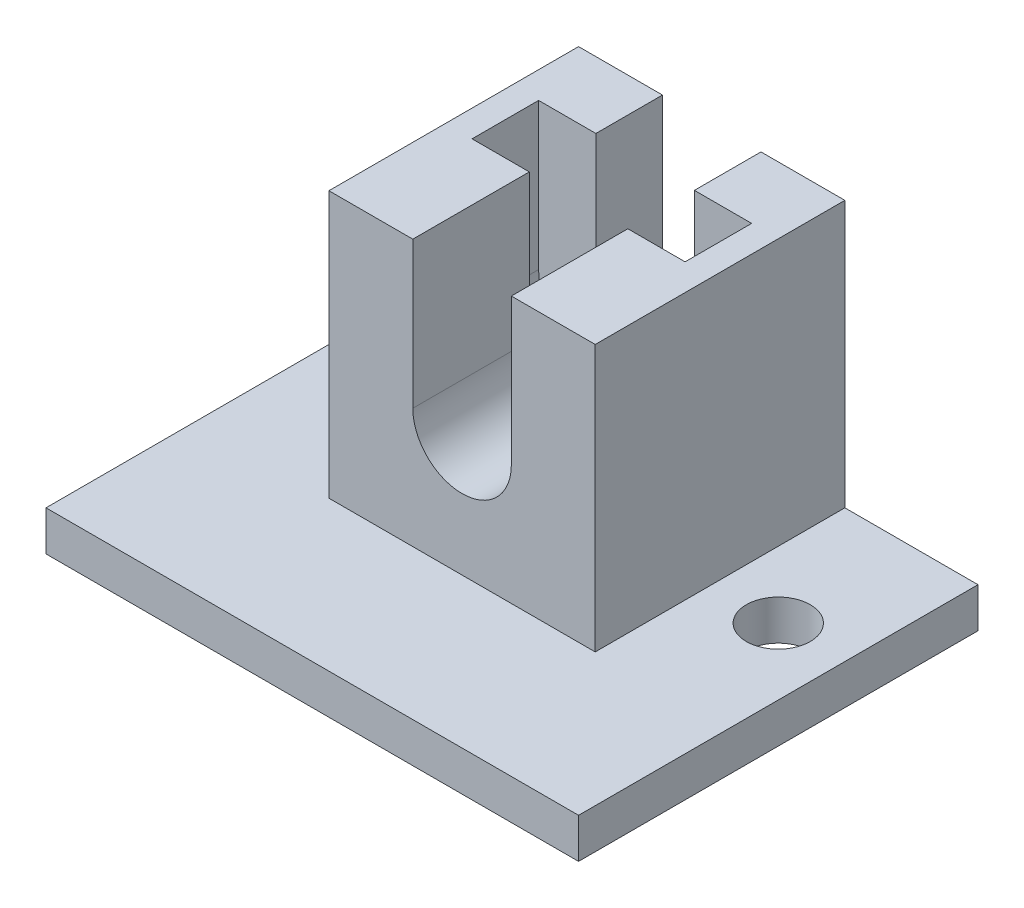
from build123d import *

# Parameters (mm, degrees)
ESQUISSE3_W                  = 10
ESQUISSE3_H                  = 15
ESQUISSE3_H_2                = 10
ESQUISSE3_H_3                = 5
BOSS_EXTRU_1_DEPTH           = 3
ESQUISSE4_W                  = 10
ESQUISSE4_H                  = 5
ESQUISSE4_H_2                = 3.75
BOSS_EXTRU_2_DEPTH           = 17
ENL_V_MAT_EXTRU_1_DEPTH      = 5
ENL_V_MAT_EXTRU_2_DEPTH      = 18.75
ESQUISSE8_W                  = 20
ESQUISSE8_H                  = 18.75
ESQUISSE8_W_2                = 16
ESQUISSE8_H_2                = 5
BOSS_EXTRU_3_DEPTH           = 3
ESQUISSE9_R                  = 3.7
ESQUISSE9_R_2                = 3
ENL_V_MAT_EXTRU_3_DEPTH      = 43.790987898
ENL_V_START                  = -6
ESQUISSE10_R                 = 2.4
ESQUISSE10_R_2               = 2
ENL_V_MAT_EXTRU_4_DEPTH      = 6
ENL_V_MAT_EXTRU_5_REACH      = 36.283
ENL_V_MAT_EXTRU_5_END_RADIUS = 3.7
ESQUISSE12_W                 = 3.7
ESQUISSE12_H                 = 5
ESQUISSE12_W_2               = 7.4
ESQUISSE12_H_2               = 8.75


with BuildPart() as part:
    # Esquisse3 → Boss.-Extru.1 (new body)
    with BuildSketch(Plane(origin=(0, 0, 0), x_dir=(1, 0, 0), z_dir=(0, 1, 0))):
        with Locations((-15.05164944, -6.870348765)):
            Rectangle(ESQUISSE3_W, ESQUISSE3_H)
        with Locations((14.94835056, -6.870348765)):
            Rectangle(ESQUISSE3_W, ESQUISSE3_H)
        with BuildLine():
            Line((-10.05164944, 5.629651235), (-10.05164944, 15.629651235))
            Line((-10.05164944, 15.629651235), (-20.05164944, 15.629651235))
            Line((-20.05164944, 15.629651235), (-20.05164944, 5.629651235))
            Line((-20.05164944, 5.629651235), (-17.05164944, 5.629651235))
            ThreePointArc((-17.05164944, 5.629651235), (-15.05164944, 7.629651235), (-13.05164944, 5.629651235))
            Line((-13.05164944, 5.629651235), (-10.05164944, 5.629651235))
        make_face()
        with BuildLine():
            Line((-10.05164944, 0.629651235), (-10.05164944, 5.629651235))
            Line((-10.05164944, 5.629651235), (-13.05164944, 5.629651235))
            ThreePointArc((-13.05164944, 5.629651235), (-15.05164944, 3.629651235), (-17.05164944, 5.629651235))
            Line((-17.05164944, 5.629651235), (-20.05164944, 5.629651235))
            Line((-20.05164944, 5.629651235), (-20.05164944, 0.629651235))
            Line((-20.05164944, 0.629651235), (-10.05164944, 0.629651235))
        make_face()
        with Locations((-5.05164944, 10.629651235)):
            Rectangle(ESQUISSE3_W, ESQUISSE3_H_2)
        with Locations((4.94835056, 10.629651235)):
            Rectangle(ESQUISSE3_W, ESQUISSE3_H_2)
        with BuildLine():
            Line((19.94835056, 15.629651235), (9.94835056, 15.629651235))
            Line((9.94835056, 15.629651235), (9.94835056, 5.629651235))
            Line((9.94835056, 5.629651235), (12.94835056, 5.629651235))
            ThreePointArc((12.94835056, 5.629651235), (14.94835056, 7.629651235), (16.94835056, 5.629651235))
            Line((16.94835056, 5.629651235), (19.94835056, 5.629651235))
            Line((19.94835056, 5.629651235), (19.94835056, 15.629651235))
        make_face()
        with BuildLine():
            Line((12.94835056, 5.629651235), (9.94835056, 5.629651235))
            Line((9.94835056, 5.629651235), (9.94835056, 0.629651235))
            Line((9.94835056, 0.629651235), (19.94835056, 0.629651235))
            Line((19.94835056, 0.629651235), (19.94835056, 5.629651235))
            Line((19.94835056, 5.629651235), (16.94835056, 5.629651235))
            ThreePointArc((16.94835056, 5.629651235), (14.94835056, 3.629651235), (12.94835056, 5.629651235))
        make_face()
        with Locations((4.94835056, -6.870348765)):
            Rectangle(ESQUISSE3_W, ESQUISSE3_H)
        with Locations((-5.05164944, -6.870348765)):
            Rectangle(ESQUISSE3_W, ESQUISSE3_H)
        with Locations((4.94835056, 3.129651235)):
            Rectangle(ESQUISSE3_W, ESQUISSE3_H_3)
        with Locations((-5.05164944, 3.129651235)):
            Rectangle(ESQUISSE3_W, ESQUISSE3_H_3)
    extrude(amount=BOSS_EXTRU_1_DEPTH)

    # Esquisse4 → Boss.-Extru.2 (add)
    with BuildSketch(Plane(origin=(0, 3, 0), x_dir=(1, 0, 0), z_dir=(0, 1, 0))):
        with Locations((-5.05164944, 3.129651235)):
            Rectangle(ESQUISSE4_W, ESQUISSE4_H)
        with Locations((-5.05164944, -1.245348765)):
            Rectangle(ESQUISSE4_W, ESQUISSE4_H_2)
        with Locations((4.94835056, -1.245348765)):
            Rectangle(ESQUISSE4_W, ESQUISSE4_H_2)
        with Locations((4.94835056, 3.129651235)):
            Rectangle(ESQUISSE4_W, ESQUISSE4_H)
        Polygon((-0.05164944, 15.629651235), (-0.05164944, 5.629651235), (9.94835056, 5.629651235), (9.94835056, 8.129651235), align=None)
        Polygon((-10.05164944, 8.129651235), (-10.05164944, 5.629651235), (-0.05164944, 5.629651235), (-0.05164944, 15.629651235), align=None)
        Polygon((-10.05164944, 15.629651235), (-10.05164944, 8.129651235), (-0.05164944, 15.629651235), align=None)
        Polygon((9.94835056, 15.629651235), (-0.05164944, 15.629651235), (9.94835056, 8.129651235), align=None)
    extrude(amount=BOSS_EXTRU_2_DEPTH)

    # Esquisse6 → Enlèv. mat.-Extru.1 (cut)
    with BuildSketch(Plane(origin=(0, 0, -10.629651235), x_dir=(-1, 0, 0), z_dir=(0, 0, -1))):
        with BuildLine():
            Line((8.05164944, 20), (-7.94835056, 20))
            Line((-7.94835056, 20), (-7.94835056, 12))
            ThreePointArc((-7.94835056, 12), (0.05164944, 4), (8.05164944, 12))
            Line((8.05164944, 12), (8.05164944, 20))
        make_face()
    extrude(amount=-ENL_V_MAT_EXTRU_1_DEPTH, mode=Mode.SUBTRACT)

    # Esquisse7 → Enlèv. mat.-Extru.2 (cut)
    with BuildSketch(Plane(origin=(0, 0, -15.629651235), x_dir=(-1, 0, 0), z_dir=(0, 0, -1))):
        with BuildLine():
            ThreePointArc((3.05164944, 12), (2.823288037, 13.148050297), (2.172969783, 14.121320344))
            Line((2.172969783, 14.121320344), (0.05164944, 12))
            Line((0.05164944, 12), (2.172969783, 9.878679656))
            ThreePointArc((2.172969783, 9.878679656), (2.823288037, 10.851949703), (3.05164944, 12))
        make_face()
        with BuildLine():
            Line((0.05164944, 12), (2.172969783, 14.121320344))
            ThreePointArc((2.172969783, 14.121320344), (0.05164944, 15), (-2.069670904, 14.121320344))
            Line((-2.069670904, 14.121320344), (0.05164944, 12))
        make_face()
        with BuildLine():
            ThreePointArc((-2.069670904, 9.878679656), (0.05164944, 9), (2.172969783, 9.878679656))
            Line((2.172969783, 9.878679656), (0.05164944, 12))
            Line((0.05164944, 12), (-2.069670904, 9.878679656))
        make_face()
        with BuildLine():
            Line((0.05164944, 12), (-2.069670904, 14.121320344))
            ThreePointArc((-2.069670904, 14.121320344), (-2.94835056, 12), (-2.069670904, 9.878679656))
            Line((-2.069670904, 9.878679656), (0.05164944, 12))
        make_face()
    extrude(amount=-ENL_V_MAT_EXTRU_2_DEPTH, mode=Mode.SUBTRACT)

    # Esquisse8 → Boss.-Extru.3 (add)
    with BuildSketch(Plane(origin=(0, 20, 0), x_dir=(1, 0, 0), z_dir=(0, 1, 0))):
        with Locations((-0.05164944, 6.254651235)):
            Rectangle(ESQUISSE8_W, ESQUISSE8_H)
        with Locations((-0.05164944, 8.129651235)):
            Rectangle(ESQUISSE8_W_2, ESQUISSE8_H_2, mode=Mode.SUBTRACT)
    extrude(amount=BOSS_EXTRU_3_DEPTH)

    # Esquisse9 → Enlèv. mat.-Extru.3 (cut, through all)
    with BuildSketch(Plane(origin=(0, 0, -15.629651235), x_dir=(-1, 0, 0), z_dir=(0, 0, -1))):
        with Locations((0.05164944, 12)):
            Circle(ESQUISSE9_R)
        with Locations((0.05164944, 12)):
            Circle(ESQUISSE9_R_2, mode=Mode.SUBTRACT)
    extrude(amount=-ENL_V_MAT_EXTRU_3_DEPTH, mode=Mode.SUBTRACT)

    # Esquisse10 → Enlèv. mat.-Extru.4 (cut)
    # profile 1 of 2: a face of its own
    with BuildSketch(Plane(origin=(0, 3, 0), x_dir=(1, 0, 0), z_dir=(0, 1, 0)).offset(ENL_V_START)):
        with Locations(Location((-15.05164944, 5.629651235, 0), (0, 0, 270))):
            Circle(ESQUISSE10_R)
        with Locations((-15.05164944, 5.629651235)):
            Circle(ESQUISSE10_R_2, mode=Mode.SUBTRACT)
    # profile 2 of 2: a face of its own
    with BuildSketch(Plane(origin=(0, 3, 0), x_dir=(1, 0, 0), z_dir=(0, 1, 0)).offset(ENL_V_START)):
        with Locations(Location((14.94835056, 5.629651235, 0), (0, 0, 270))):
            Circle(ESQUISSE10_R)
        with Locations((14.94835056, 5.629651235)):
            Circle(ESQUISSE10_R_2, mode=Mode.SUBTRACT)
    extrude(amount=ENL_V_MAT_EXTRU_4_DEPTH, mode=Mode.SUBTRACT)

    # Enlèv. mat.-Extru.5: up to this cylinder (the profile starts outside it)
    enl_v_mat_extru_5_end = Plane(origin=(-0.05164944, 12, -7.192151), z_dir=(0, 0, -1)) * Cylinder(ENL_V_MAT_EXTRU_5_END_RADIUS, 92.841, mode=Mode.PRIVATE)
    # Esquisse12 → Enlèv. mat.-Extru.5 (cut, up to the surface)
    with BuildSketch(Plane(origin=(0, 23, 0), x_dir=(1, 0, 0), z_dir=(0, 1, 0)), mode=Mode.PRIVATE) as enl_v_mat_extru_5_sk1:
        with Locations((-1.90164944, 13.129651235)):
            Rectangle(ESQUISSE12_W, ESQUISSE12_H)
    enl_v_mat_extru_5_tool1 = extrude(enl_v_mat_extru_5_sk1.sketch, amount=-ENL_V_MAT_EXTRU_5_REACH, mode=Mode.PRIVATE) - enl_v_mat_extru_5_end
    add(enl_v_mat_extru_5_tool1.solids().sort_by_distance((-1.901649, 23, -13.129651))[0], mode=Mode.SUBTRACT)
    # Esquisse12 → Enlèv. mat.-Extru.5 (cut, up to the surface)
    with BuildSketch(Plane(origin=(0, 23, 0), x_dir=(1, 0, 0), z_dir=(0, 1, 0)), mode=Mode.PRIVATE) as enl_v_mat_extru_5_sk2:
        with Locations((1.79835056, 13.129651235)):
            Rectangle(ESQUISSE12_W, ESQUISSE12_H)
    enl_v_mat_extru_5_tool2 = extrude(enl_v_mat_extru_5_sk2.sketch, amount=-ENL_V_MAT_EXTRU_5_REACH, mode=Mode.PRIVATE) - enl_v_mat_extru_5_end
    add(enl_v_mat_extru_5_tool2.solids().sort_by_distance((1.798351, 23, -13.129651))[0], mode=Mode.SUBTRACT)
    # Esquisse12 → Enlèv. mat.-Extru.5 (cut, up to the surface)
    with BuildSketch(Plane(origin=(0, 23, 0), x_dir=(1, 0, 0), z_dir=(0, 1, 0)), mode=Mode.PRIVATE) as enl_v_mat_extru_5_sk3:
        with Locations((-0.05164944, 1.254651235)):
            Rectangle(ESQUISSE12_W_2, ESQUISSE12_H_2)
    enl_v_mat_extru_5_tool3 = extrude(enl_v_mat_extru_5_sk3.sketch, amount=-ENL_V_MAT_EXTRU_5_REACH, mode=Mode.PRIVATE) - enl_v_mat_extru_5_end
    add(enl_v_mat_extru_5_tool3.solids().sort_by_distance((-0.051649, 23, -1.254651))[0], mode=Mode.SUBTRACT)


solid = part.part
